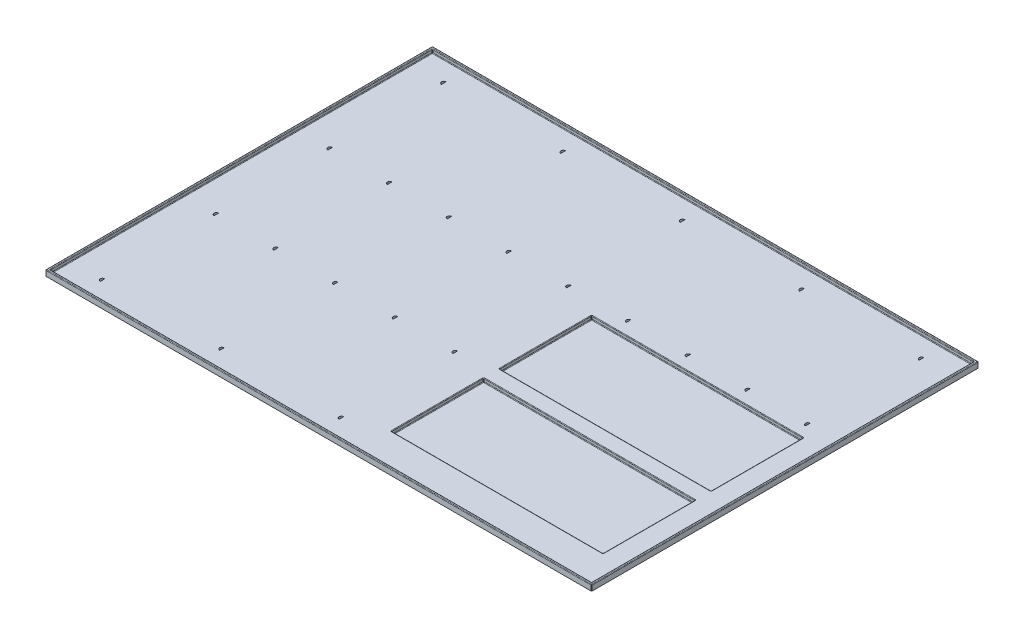
from build123d import *

# Parameters (mm, degrees)
SKETCH1_W               = 609.6
SKETCH1_H               = 431.8
TRAY_BASE_DEPTH         = 6.35
SQUARE_INDENT_REACH     = 749.105
SKETCH8_W               = 241.3
SKETCH8_H               = 107.95
SHELL2_T                = -2.54
CUT_EXTRUDE1_DEPTH      = 748.063399251
CUT_EXTRUDE1_DEPTH_BACK = 748.063399251
SKETCH34_R              = 3.175
BOSS_EXTRUDE1_DEPTH     = 3.81
FILLET1_R               = 0.635


with BuildPart() as part:
    # Sketch1 → Tray Base (new body)
    with BuildSketch(Plane(origin=(0, 0, 0), x_dir=(1, 0, 0), z_dir=(0, 1, 0))):
        with Locations((304.8, 215.9)):
            Rectangle(SKETCH1_W, SKETCH1_H)
    extrude(amount=TRAY_BASE_DEPTH)

    # Sketch8 → Square Indent (add, up to next)
    with BuildSketch(Plane(origin=(0, -3.81, 0), x_dir=(-1, 0, 0), z_dir=(0, -1, 0)), mode=Mode.PRIVATE) as square_indent_sk1:
        with Locations((-463.55, 212.725)):
            Rectangle(SKETCH8_W, SKETCH8_H)
    square_indent_tool1 = extrude(square_indent_sk1.sketch, amount=-SQUARE_INDENT_REACH, mode=Mode.PRIVATE) - part.part
    # Sketch8 → Square Indent (add, up to next)
    with BuildSketch(Plane(origin=(0, -3.81, 0), x_dir=(-1, 0, 0), z_dir=(0, -1, 0)), mode=Mode.PRIVATE) as square_indent_sk2:
        with Locations((-463.55, 92.075)):
            Rectangle(SKETCH8_W, SKETCH8_H)
    square_indent_tool2 = extrude(square_indent_sk2.sketch, amount=-SQUARE_INDENT_REACH, mode=Mode.PRIVATE) - part.part
    add(square_indent_tool1.solids().sort_by_distance((463.55, -3.81, -212.725))[0])
    add(square_indent_tool2.solids().sort_by_distance((463.55, -3.81, -92.075))[0])

    # Shell2
    shell2_openings = [part.faces().sort_by_distance(p)[0] for p in [
        (304.8, 6.35, -215.9),
    ]]
    offset(amount=SHELL2_T, openings=shell2_openings, kind=Kind.INTERSECTION)

    # Sketch32 → Cut-Extrude1 (cut, two sides: drawn at the far end of the back side and taken through both)
    with BuildSketch(Plane(origin=(0, 0, 0), x_dir=(1, 0, 0), z_dir=(0, 1, 0)).offset(-CUT_EXTRUDE1_DEPTH_BACK)):
        with BuildLine():
            Line((38.1, 27.94), (38.1, 22.86))
            ThreePointArc((38.1, 22.86), (35.56, 25.4), (38.1, 27.94))
        make_face()
        with BuildLine():
            Line((38.1, 154.94), (38.1, 149.86))
            ThreePointArc((38.1, 149.86), (35.56, 152.4), (38.1, 154.94))
        make_face()
        with BuildLine():
            Line((38.1, 281.94), (38.1, 276.86))
            ThreePointArc((38.1, 276.86), (35.56, 279.4), (38.1, 281.94))
        make_face()
        with BuildLine():
            Line((38.1, 408.94), (38.1, 403.86))
            ThreePointArc((38.1, 403.86), (35.56, 406.4), (38.1, 408.94))
        make_face()
        with BuildLine():
            Line((171.45, 27.94), (171.45, 22.86))
            ThreePointArc((171.45, 22.86), (168.91, 25.4), (171.45, 27.94))
        make_face()
        with BuildLine():
            Line((304.8, 27.94), (304.8, 22.86))
            ThreePointArc((304.8, 22.86), (302.26, 25.4), (304.8, 27.94))
        make_face()
        with BuildLine():
            Line((104.775, 154.94), (104.775, 149.86))
            ThreePointArc((104.775, 149.86), (102.235, 152.4), (104.775, 154.94))
        make_face()
        with BuildLine():
            Line((171.45, 154.94), (171.45, 149.86))
            ThreePointArc((171.45, 149.86), (168.91, 152.4), (171.45, 154.94))
        make_face()
        with BuildLine():
            Line((238.125, 154.94), (238.125, 149.86))
            ThreePointArc((238.125, 149.86), (235.585, 152.4), (238.125, 154.94))
        make_face()
        with BuildLine():
            Line((304.8, 154.94), (304.8, 149.86))
            ThreePointArc((304.8, 149.86), (302.26, 152.4), (304.8, 154.94))
        make_face()
        with BuildLine():
            Line((104.775, 281.94), (104.775, 276.86))
            ThreePointArc((104.775, 276.86), (102.235, 279.4), (104.775, 281.94))
        make_face()
        with BuildLine():
            Line((171.45, 281.94), (171.45, 276.86))
            ThreePointArc((171.45, 276.86), (168.91, 279.4), (171.45, 281.94))
        make_face()
        with BuildLine():
            Line((238.125, 281.94), (238.125, 276.86))
            ThreePointArc((238.125, 276.86), (235.585, 279.4), (238.125, 281.94))
        make_face()
        with BuildLine():
            Line((304.8, 281.94), (304.8, 276.86))
            ThreePointArc((304.8, 276.86), (302.26, 279.4), (304.8, 281.94))
        make_face()
        with BuildLine():
            Line((371.475, 281.94), (371.475, 276.86))
            ThreePointArc((371.475, 276.86), (368.935, 279.4), (371.475, 281.94))
        make_face()
        with BuildLine():
            Line((438.15, 281.94), (438.15, 276.86))
            ThreePointArc((438.15, 276.86), (435.61, 279.4), (438.15, 281.94))
        make_face()
        with BuildLine():
            Line((504.825, 281.94), (504.825, 276.86))
            ThreePointArc((504.825, 276.86), (502.285, 279.4), (504.825, 281.94))
        make_face()
        with BuildLine():
            Line((571.5, 281.94), (571.5, 276.86))
            ThreePointArc((571.5, 276.86), (568.96, 279.4), (571.5, 281.94))
        make_face()
        with BuildLine():
            Line((171.45, 408.94), (171.45, 403.86))
            ThreePointArc((171.45, 403.86), (168.91, 406.4), (171.45, 408.94))
        make_face()
        with BuildLine():
            Line((304.8, 408.94), (304.8, 403.86))
            ThreePointArc((304.8, 403.86), (302.26, 406.4), (304.8, 408.94))
        make_face()
        with BuildLine():
            Line((438.15, 408.94), (438.15, 403.86))
            ThreePointArc((438.15, 403.86), (435.61, 406.4), (438.15, 408.94))
        make_face()
        with BuildLine():
            Line((571.5, 408.94), (571.5, 403.86))
            ThreePointArc((571.5, 403.86), (568.96, 406.4), (571.5, 408.94))
        make_face()
    extrude(amount=CUT_EXTRUDE1_DEPTH + CUT_EXTRUDE1_DEPTH_BACK, mode=Mode.SUBTRACT)

    # Sketch34 → Boss-Extrude1 (add)
    with BuildSketch(Plane.XZ):
        with Locations(Location((12.7, -12.7, 0), (0, 0, 90))):
            Circle(SKETCH34_R)
        with Locations(Location((596.9, -12.7, 0), (0, 0, 90))):
            Circle(SKETCH34_R)
        with Locations(Location((596.9, -419.1, 0), (0, 0, 90))):
            Circle(SKETCH34_R)
        with Locations(Location((12.7, -419.1, 0), (0, 0, 90))):
            Circle(SKETCH34_R)
    extrude(amount=BOSS_EXTRUDE1_DEPTH)

    # Fillet1
    fillet1_edges = [part.edges().sort_by_distance(p)[0] for p in [
        (304.8, 6.35, -431.8),
        (0, 6.35, -215.9),
        (584.2, -3.81, -212.725),
        (463.55, -3.81, -266.7),
        (463.55, -3.81, -158.75),
        (342.9, -3.81, -212.725),
        (463.55, -3.81, -146.05),
        (342.9, -3.81, -92.075),
        (584.2, -3.81, -92.075),
        (463.55, -3.81, -38.1),
        (12.7, -3.81, -15.875),
        (596.9, -3.81, -15.875),
        (596.9, -3.81, -422.275),
        (12.7, -3.81, -422.275),
        (304.8, 6.35, 0),
        (304.8, 2.54, -2.54),
        (2.54, 4.445, -2.54),
        (607.06, 2.54, -215.9),
        (607.06, 4.445, -2.54),
        (304.8, 6.35, -429.26),
        (607.06, 4.445, -429.26),
        (2.54, 6.35, -215.9),
        (2.54, 4.445, -429.26),
        (304.8, 6.35, -2.54),
        (607.06, 6.35, -215.9),
        (463.55, 2.54, -40.64),
        (581.66, 2.54, -92.075),
        (345.44, 2.54, -212.725),
        (463.55, 2.54, -161.29),
        (2.54, 2.54, -215.9),
        (304.8, 2.54, -429.26),
        (345.44, 0.635, -161.29),
        (581.66, 2.54, -212.725),
        (581.66, 0.635, -161.29),
        (581.66, -1.27, -212.725),
        (463.55, 2.54, -264.16),
        (581.66, 0.635, -264.16),
        (463.55, -1.27, -264.16),
        (345.44, 0.635, -264.16),
        (463.55, -1.27, -161.29),
        (345.44, -1.27, -212.725),
        (581.66, 0.635, -40.64),
        (463.55, 2.54, -143.51),
        (581.66, 0.635, -143.51),
        (463.55, -1.27, -143.51),
        (345.44, 2.54, -92.075),
        (345.44, 0.635, -143.51),
        (345.44, -1.27, -92.075),
        (345.44, 0.635, -40.64),
        (581.66, -1.27, -92.075),
        (463.55, -1.27, -40.64),
        (0, 3.175, 0),
        (0, 3.175, -431.8),
        (609.6, 3.175, -431.8),
        (609.6, 3.175, 0),
        (609.6, 6.35, -215.9),
    ]]
    fillet(fillet1_edges, radius=FILLET1_R)


solid = part.part
